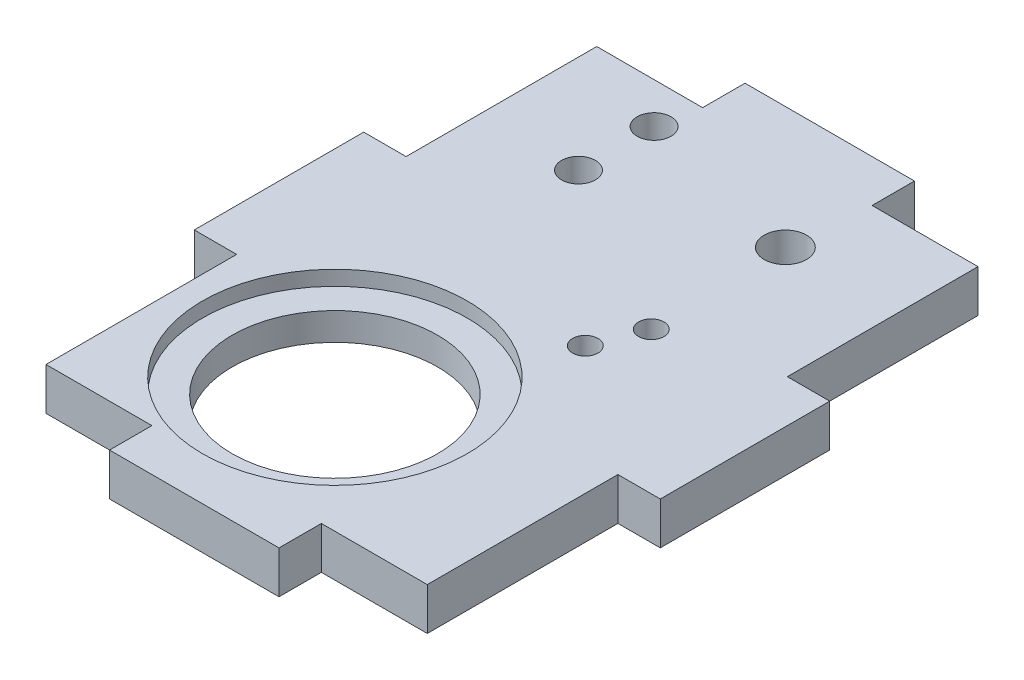
from build123d import *

# Parameters (mm, degrees)
SKETCH1_W           = 90
SKETCH1_H           = 130
SKETCH1_W_2         = 10
SKETCH1_H_2         = 40
SKETCH1_W_3         = 40
SKETCH1_H_3         = 10
BOSS_EXTRUDE1_DEPTH = 10
SKETCH2_R           = 4
CUT_EXTRUDE1_DEPTH  = 173.336879396
CUT_EXTRUDE2_DEPTH  = 173.336879396
SKETCH4_R           = 31.25
CUT_EXTRUDE3_DEPTH  = 3.5
SKETCH5_R           = 24.25
CUT_EXTRUDE4_DEPTH  = 173.169248125
SKETCH6_R           = 5
CUT_EXTRUDE5_DEPTH  = 173.336879396


with BuildPart() as part:
    # Sketch1 → Boss-Extrude1 (new body)
    with BuildSketch(Plane(origin=(0, 0, 0), x_dir=(1, 0, 0), z_dir=(0, 1, 0))):
        with Locations((45, 65)):
            Rectangle(SKETCH1_W, SKETCH1_H)
        with Locations((-5, 65)):
            Rectangle(SKETCH1_W_2, SKETCH1_H_2)
        with Locations((95, 65)):
            Rectangle(SKETCH1_W_2, SKETCH1_H_2)
        with Locations((45, -5)):
            Rectangle(SKETCH1_W_3, SKETCH1_H_3)
        with Locations((45, 135)):
            Rectangle(SKETCH1_W_3, SKETCH1_H_3)
    extrude(amount=BOSS_EXTRUDE1_DEPTH)

    # Sketch2 → Cut-Extrude1 (cut, through all)
    with BuildSketch(Plane(origin=(0, 10, 0), x_dir=(1, 0, 0), z_dir=(0, 1, 0))):
        with Locations(Location((23.122776972, 102.57, 0), (0, 0, 270))):
            Circle(SKETCH2_R)
        with Locations(Location((23.122776972, 120.41, 0), (0, 0, 270))):
            Circle(SKETCH2_R)
    extrude(amount=-CUT_EXTRUDE1_DEPTH, mode=Mode.SUBTRACT)

    # Sketch3 → Cut-Extrude2 (cut, through all)
    with BuildSketch(Plane(origin=(0, 10, 0), x_dir=(1, 0, 0), z_dir=(0, 1, 0))):
        with BuildLine():
            ThreePointArc((65.351977614, 81.42565129), (61.457970709, 79.741397678), (63.142224321, 75.847390774))
            Line((63.142224321, 75.847390774), (65.351977614, 81.42565129))
        make_face()
        with BuildLine():
            Line((65.351977614, 81.42565129), (63.142224321, 75.847390774))
            ThreePointArc((63.142224321, 75.847390774), (65.93312737, 76.155127276), (67.247100967, 78.636521032))
            ThreePointArc((67.247100967, 78.636521032), (66.728494723, 80.322547434), (65.351977614, 81.42565129))
        make_face()
        with BuildLine():
            ThreePointArc((58.722717735, 64.690869742), (61.513620784, 64.998606245), (62.827594381, 67.48))
            Line((62.827594381, 67.48), (59.827594381, 67.48))
            Line((59.827594381, 67.48), (58.722717735, 64.690869742))
        make_face()
        with BuildLine():
            Line((59.827594381, 67.48), (62.827594381, 67.48))
            ThreePointArc((62.827594381, 67.48), (62.308988137, 69.166026403), (60.932471028, 70.269130258))
            Line((60.932471028, 70.269130258), (59.827594381, 67.48))
        make_face()
        with BuildLine():
            Line((58.722717735, 64.690869742), (59.827594381, 67.48))
            Line((59.827594381, 67.48), (56.827594381, 67.48))
            ThreePointArc((56.827594381, 67.48), (57.346200626, 65.793973597), (58.722717735, 64.690869742))
        make_face()
        with BuildLine():
            Line((56.827594381, 67.48), (59.827594381, 67.48))
            Line((59.827594381, 67.48), (60.932471028, 70.269130258))
            ThreePointArc((60.932471028, 70.269130258), (58.141567979, 69.961393755), (56.827594381, 67.48))
        make_face()
    extrude(amount=-CUT_EXTRUDE2_DEPTH, mode=Mode.SUBTRACT)

    # Sketch4 → Cut-Extrude3 (cut)
    with BuildSketch(Plane(origin=(0, 10, 0), x_dir=(1, 0, 0), z_dir=(0, 1, 0))):
        with Locations(Location((36.72, 31.47, 0), (0, 0, 270))):
            Circle(SKETCH4_R)
    extrude(amount=-CUT_EXTRUDE3_DEPTH, mode=Mode.SUBTRACT)

    # Sketch5 → Cut-Extrude4 (cut, through all)
    with BuildSketch(Plane(origin=(0, 6.5, 0), x_dir=(1, 0, 0), z_dir=(0, 1, 0))):
        with Locations(Location((36.72, 31.47, 0), (0, 0, 270))):
            Circle(SKETCH5_R)
    extrude(amount=-CUT_EXTRUDE4_DEPTH, mode=Mode.SUBTRACT)

    # Sketch6 → Cut-Extrude5 (cut, through all)
    with BuildSketch(Plane(origin=(0, 10, 0), x_dir=(1, 0, 0), z_dir=(0, 1, 0))):
        with Locations(Location((63.314917683, 111.209559188, 0), (0, 0, 270))):
            Circle(SKETCH6_R)
    extrude(amount=-CUT_EXTRUDE5_DEPTH, mode=Mode.SUBTRACT)


solid = part.part
